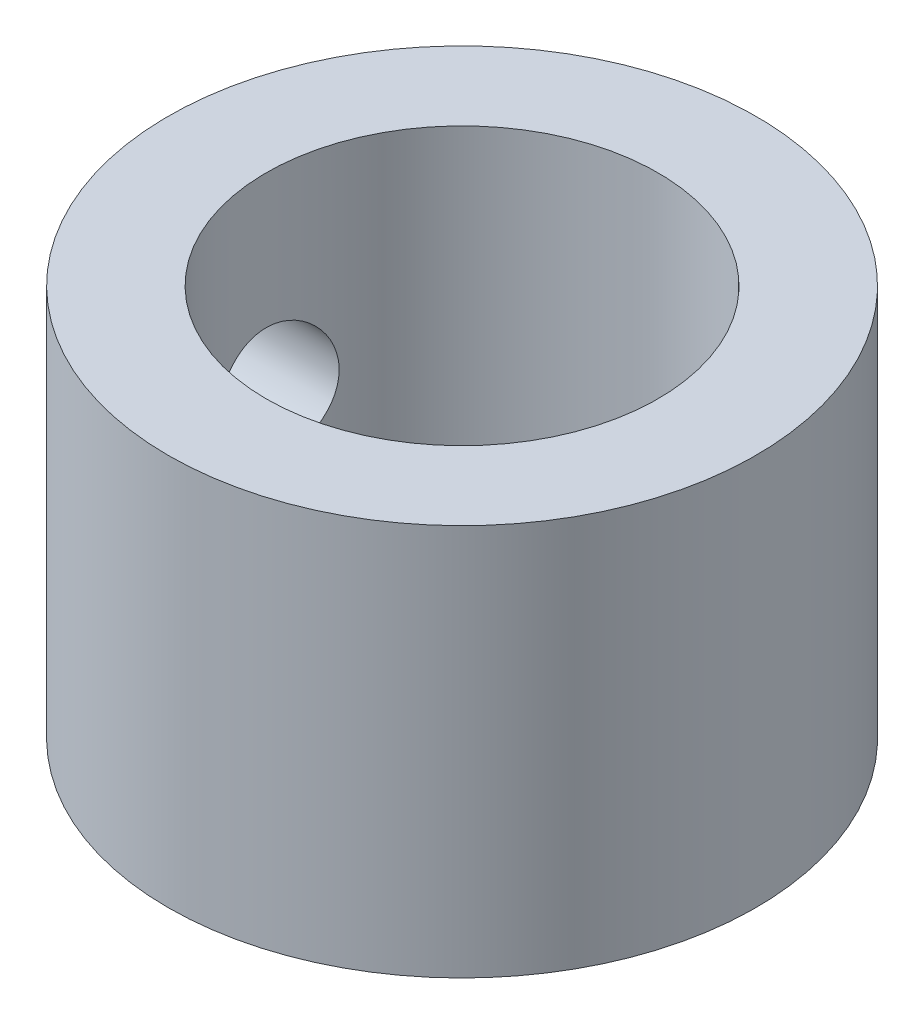
from build123d import *

# Parameters (mm, degrees)
SKETCH1_R           = 9.525
BOSS_EXTRUDE1_DEPTH = 12.7
SKETCH2_R           = 6.35
CUT_EXTRUDE1_DEPTH  = 9.525
SKETCH3_R           = 2.032
CUT_EXTRUDE2_DEPTH  = 19.513272266
SKETCH4_R           = 5.23875
CUT_EXTRUDE3_DEPTH  = 19.513272438


with BuildPart() as part:
    # Sketch1 → Boss-Extrude1 (new body)
    with BuildSketch(Plane(origin=(0, 0, 0), x_dir=(1, 0, 0), z_dir=(0, 1, 0))):
        with Locations(Location((0, 0, 0), (0, 0, 270))):
            Circle(SKETCH1_R)
    extrude(amount=BOSS_EXTRUDE1_DEPTH)

    # Sketch2 → Cut-Extrude1 (cut)
    with BuildSketch(Plane(origin=(0, 12.7, 0), x_dir=(1, 0, 0), z_dir=(0, 1, 0))):
        with Locations(Location((0, 0, 0), (0, 0, 270))):
            Circle(SKETCH2_R)
    extrude(amount=-CUT_EXTRUDE1_DEPTH, mode=Mode.SUBTRACT)

    # Sketch3 → Cut-Extrude2 (cut, through all)
    with BuildSketch(Plane(origin=(0, 0, 0), x_dir=(0, 0, -1), z_dir=(1, 0, 0))):
        with Locations((0, 6.318769588)):
            Circle(SKETCH3_R)
    extrude(amount=-CUT_EXTRUDE2_DEPTH, mode=Mode.SUBTRACT)

    # Sketch4 → Cut-Extrude3 (cut, through all)
    with BuildSketch(Plane.XZ):
        with Locations(Location((0, 0, 0), (0, 0, 270))):
            Circle(SKETCH4_R)
    extrude(amount=-CUT_EXTRUDE3_DEPTH, mode=Mode.SUBTRACT)


solid = part.part
